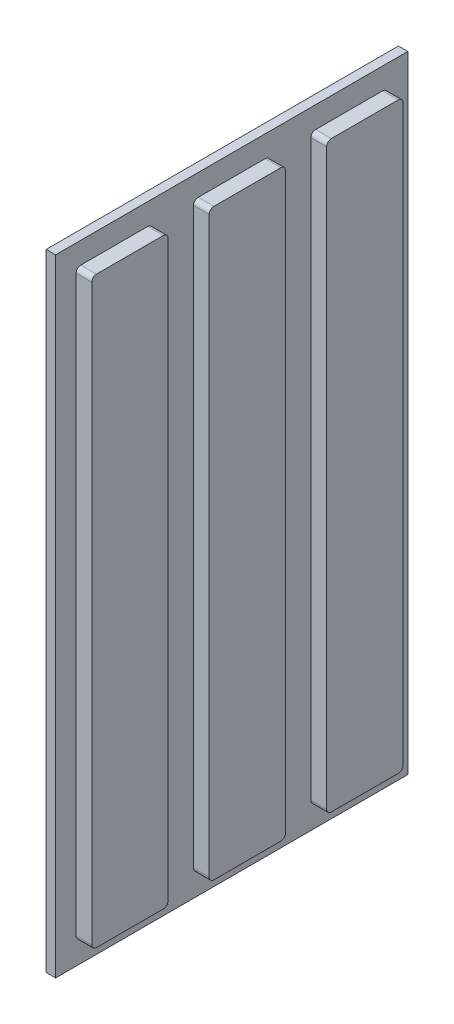
from build123d import *

# Parameters (mm, degrees)
SKETCH1_W           = 80
SKETCH1_H           = 45
BOSS_EXTRUDE1_DEPTH = 1.2
SKETCH2_W           = 74.5
SKETCH2_H           = 9.75
BOSS_EXTRUDE2_DEPTH = 2
LPATTERN1_COUNT     = 3
LPATTERN1_PITCH     = 15
SKETCH3_W           = 2.467948718
SKETCH3_H           = 0.224358974
CUT_EXTRUDE1_DEPTH  = 0.6
FILLET1_R           = 0.6


with BuildPart() as part:
    # Sketch1 → Boss-Extrude1 (new body)
    with BuildSketch(Plane.YZ):
        Rectangle(SKETCH1_W, SKETCH1_H)
    extrude(amount=-BOSS_EXTRUDE1_DEPTH)

    # Sketch2 → Boss-Extrude2 (add)
    with BuildSketch(Plane.YZ):
        with Locations((0, 15)):
            Rectangle(SKETCH2_W, SKETCH2_H)
    boss_extrude2 = extrude(amount=BOSS_EXTRUDE2_DEPTH)

    # LPattern1: Boss-Extrude2 ×3
    with Locations(*[(0, 0, -i * LPATTERN1_PITCH) for i in range(1, LPATTERN1_COUNT)]):
        add(boss_extrude2)

    # Sketch3 → Cut-Extrude1 (cut)
    # profile 1 of 10: a face of its own
    with BuildSketch(Plane(origin=(-1.2, 0, 0), x_dir=(0, -1, 0), z_dir=(-1, 0, 0))):
        with BuildLine():
            Line((-12.101362179, 4.78525641), (-12.658052885, 5.065705128))
            Line((-12.658052885, 5.065705128), (-12.048076923, 6.266025641))
            add(Edge.make_bspline(
                [(-12.048076923, 6.266025641), (-12.084115703, 6.266944222), (-12.154868548, 6.268747618), (-12.259046592, 6.283733822), (-12.358669547, 6.309316228), (-12.454911641, 6.343372857), (-12.546441874, 6.389029296), (-12.634370125, 6.44351786), (-12.717479169, 6.508985086), (-12.796158669, 6.582572956), (-12.867995567, 6.663911371), (-12.930348475, 6.75138946), (-12.984696207, 6.84278816), (-13.026959984, 6.940170863), (-13.060906465, 7.041722597), (-13.085709475, 7.147969005), (-13.099628269, 7.259376228), (-13.101573722, 7.335198766), (-13.102564103, 7.373798077)],
                knots=[0, 0, 0, 0, 1.014336294, 1.991387562, 2.955278539, 3.906441712, 4.859855302, 5.829322156, 6.813833455, 7.833278715, 8.858926674, 9.863225732, 10.85404919, 11.846815163, 12.845559416, 13.865450493, 14.913355531, 16, 16, 16, 16], degree=3))
            add(Edge.make_bspline(
                [(-13.102564103, 7.373798077), (-13.101645471, 7.411239029), (-13.099835326, 7.485015649), (-13.084801896, 7.593295719), (-13.060060763, 7.697260406), (-13.026116813, 7.796892046), (-12.980928779, 7.891518808), (-12.928037335, 7.982622327), (-12.863379945, 8.068317768), (-12.79033909, 8.148976108), (-12.71039975, 8.222764248), (-12.625590822, 8.287642055), (-12.536297917, 8.341873668), (-12.44366854, 8.387418218), (-12.346028345, 8.421446272), (-12.244788345, 8.447120187), (-12.139194366, 8.461937705), (-12.067519376, 8.463800811), (-12.03125, 8.46474359)],
                knots=[0, 0, 0, 0, 1.055538678, 2.079917126, 3.075849687, 4.065898488, 5.041806164, 6.028602842, 7.031727914, 8.062953097, 9.093756959, 10.095582084, 11.068815425, 12.035667573, 13.000833448, 13.979119574, 14.977382875, 16, 16, 16, 16], degree=3))
            add(Edge.make_bspline(
                [(-12.03125, 8.46474359), (-11.99332598, 8.463962965), (-11.918753525, 8.462427971), (-11.809589466, 8.445489925), (-11.705145713, 8.419503864), (-11.604997894, 8.384209492), (-11.510389302, 8.336307724), (-11.420528301, 8.278897121), (-11.335713797, 8.210707436), (-11.256856635, 8.133704107), (-11.185136929, 8.049948579), (-11.121566332, 7.962276747), (-11.068164333, 7.870860034), (-11.024424828, 7.776514303), (-10.990351975, 7.679091749), (-10.96693123, 7.578454183), (-10.951382453, 7.4747737), (-10.949613313, 7.40447067), (-10.948717949, 7.368890224)],
                knots=[0, 0, 0, 0, 1.062826075, 2.08990367, 3.089830715, 4.078784409, 5.060762809, 6.057138927, 7.064407536, 8.107320944, 9.143871033, 10.153461498, 11.140480137, 12.108246174, 13.065926856, 14.029354859, 15.002654194, 16, 16, 16, 16], degree=3))
            add(Edge.make_bspline(
                [(-10.948717949, 7.368890224), (-10.949206557, 7.341753863), (-10.950190725, 7.287095131), (-10.959867806, 7.205128437), (-10.974549888, 7.122934565), (-10.991591552, 7.053829904), (-11.009457366, 6.995578872), (-11.026842837, 6.946163674), (-11.049148909, 6.891303526), (-11.074055868, 6.830630714), (-11.102901057, 6.764411294), (-11.13628253, 6.692961821), (-11.1721828, 6.615222629), (-11.198644844, 6.562065628), (-11.212339744, 6.534555288)],
                knots=[0, 0, 0, 0, 1.105131805, 2.225983929, 3.357782449, 4.505488967, 5.122909461, 5.839607681, 6.638776516, 7.535249922, 8.51168636, 9.581005249, 10.748097757, 12, 12, 12, 12], degree=3))
            Line((-11.212339744, 6.534555288), (-12.101362179, 4.78525641))
        make_face()
        with BuildLine():
            add(Edge.make_bspline(
                [(-12.017227564, 6.849358974), (-11.987126592, 6.851131106), (-11.928316107, 6.854593449), (-11.843838757, 6.881365028), (-11.768235823, 6.927178471), (-11.701226199, 6.988042239), (-11.645851496, 7.06229882), (-11.605590464, 7.146833337), (-11.580790908, 7.239895173), (-11.578237119, 7.304697212), (-11.576923077, 7.338040865)],
                knots=[0, 0, 0, 0, 0.984774978, 1.924027336, 2.867853169, 3.859505234, 4.871392407, 5.881338128, 6.909850265, 8, 8, 8, 8], degree=3))
            add(Edge.make_bspline(
                [(-11.576923077, 7.338040865), (-11.578505698, 7.372078143), (-11.581584273, 7.438288776), (-11.606621399, 7.533584452), (-11.649404812, 7.619726092), (-11.707609198, 7.694606899), (-11.775562059, 7.757272569), (-11.851550511, 7.803048153), (-11.933729395, 7.831354307), (-11.990600058, 7.834798478), (-12.019330929, 7.836538462)],
                knots=[0, 0, 0, 0, 1.104110315, 2.147758178, 3.172670271, 4.206310416, 5.210906102, 6.157051016, 7.068948237, 8, 8, 8, 8], degree=3))
            add(Edge.make_bspline(
                [(-12.019330929, 7.836538462), (-12.049697848, 7.834842202), (-12.109323045, 7.83151161), (-12.194849639, 7.803273431), (-12.273691733, 7.758376891), (-12.342542742, 7.6954986), (-12.40213065, 7.621603948), (-12.443682926, 7.535171542), (-12.469970335, 7.440540876), (-12.472869791, 7.374211507), (-12.474358974, 7.340144231)],
                knots=[0, 0, 0, 0, 0.970967322, 1.90648639, 2.855811969, 3.858352357, 4.877096915, 5.878517833, 6.91039038, 8, 8, 8, 8], degree=3))
            add(Edge.make_bspline(
                [(-12.474358974, 7.340144231), (-12.472803431, 7.306562559), (-12.46977806, 7.241249713), (-12.444422381, 7.147660087), (-12.403120521, 7.062678206), (-12.346657932, 6.987836006), (-12.277109926, 6.926672356), (-12.19814352, 6.881346919), (-12.11005832, 6.854520858), (-12.048728169, 6.851110576), (-12.017227564, 6.849358974)],
                knots=[0, 0, 0, 0, 1.075706617, 2.092137047, 3.084482865, 4.090466434, 5.0784141, 6.035155512, 6.990809768, 8, 8, 8, 8], degree=3))
        make_face(mode=Mode.SUBTRACT)
    # profile 2 of 10: a face of its own
    with BuildSketch(Plane(origin=(-1.2, 0, 0), x_dir=(0, -1, 0), z_dir=(-1, 0, 0))):
        with BuildLine():
            Line((-9.871794872, 7.208333333), (-10.5, 7.208333333))
            add(Edge.make_bspline(
                [(-10.5, 7.208333333), (-10.497286878, 7.255853728), (-10.491985602, 7.348705726), (-10.470898463, 7.483576225), (-10.44264242, 7.611014017), (-10.404930981, 7.730573308), (-10.357544089, 7.842210656), (-10.301701133, 7.946306638), (-10.235975451, 8.042313186), (-10.161765902, 8.129767303), (-10.08033236, 8.208223199), (-9.993365465, 8.277787125), (-9.899534942, 8.335189525), (-9.80055515, 8.382426387), (-9.696442945, 8.420166444), (-9.586213261, 8.445398727), (-9.470820526, 8.462486275), (-9.391824855, 8.463981504), (-9.3515625, 8.46474359)],
                knots=[0, 0, 0, 0, 1.199038563, 2.342849363, 3.436047546, 4.486744587, 5.497670872, 6.488682221, 7.459191391, 8.424610317, 9.374430501, 10.305433194, 11.225809216, 12.140057399, 13.06607119, 14.010487599, 14.985989317, 16, 16, 16, 16], degree=3))
            add(Edge.make_bspline(
                [(-9.3515625, 8.46474359), (-9.30214103, 8.46320151), (-9.20565874, 8.460191008), (-9.065462319, 8.434510428), (-8.934534191, 8.391555691), (-8.812969528, 8.331536594), (-8.70180323, 8.255288623), (-8.601053733, 8.164375396), (-8.513767863, 8.056889507), (-8.4393922, 7.937303267), (-8.377594913, 7.81067827), (-8.334289949, 7.679742772), (-8.305826061, 7.54797127), (-8.302790212, 7.459243011), (-8.301282051, 7.415164263)],
                knots=[0, 0, 0, 0, 1.075374347, 2.099382735, 3.09057751, 4.06680945, 5.040638231, 6.016817125, 7.011024321, 8.044445721, 9.0776792, 10.070479129, 11.0414456, 12, 12, 12, 12], degree=3))
            add(Edge.make_bspline(
                [(-8.301282051, 7.415164263), (-8.301869249, 7.388502321), (-8.303051134, 7.334838418), (-8.311268935, 7.253631761), (-8.32359726, 7.170913287), (-8.342185369, 7.086753919), (-8.365366266, 7.001130065), (-8.393488044, 6.913785484), (-8.427203016, 6.825215386), (-8.465948547, 6.734422931), (-8.512172065, 6.641113351), (-8.565992925, 6.543887899), (-8.628839657, 6.442832821), (-8.699953151, 6.337377529), (-8.779678787, 6.22768834), (-8.868405761, 6.114095673), (-8.965112146, 5.996199265), (-9.033747387, 5.917392132), (-9.069010417, 5.876903045)],
                knots=[0, 0, 0, 0, 0.728284026, 1.46585585, 2.227944881, 3.01186502, 3.81876927, 4.650621989, 5.517437689, 6.406905708, 7.346299482, 8.360816762, 9.441613733, 10.596154504, 11.834900912, 13.145207542, 14.533280747, 16, 16, 16, 16], degree=3))
            Line((-9.069010417, 5.876903045), (-9.434294872, 5.458333333))
            Line((-9.434294872, 5.458333333), (-8.256410256, 5.458333333))
            Line((-8.256410256, 5.458333333), (-8.256410256, 4.875))
            Line((-8.256410256, 4.875), (-10.58974359, 4.875))
            Line((-10.58974359, 4.875), (-10.58974359, 5.193309295))
            Line((-10.58974359, 5.193309295), (-9.553485577, 6.296173878))
            add(Edge.make_bspline(
                [(-9.553485577, 6.296173878), (-9.523483245, 6.328344781), (-9.465377624, 6.390650278), (-9.382699314, 6.48215253), (-9.307882747, 6.568985982), (-9.242479305, 6.652075237), (-9.1830567, 6.728725216), (-9.132264581, 6.801246247), (-9.089638239, 6.868982712), (-9.0433613, 6.950661059), (-8.999413421, 7.048077022), (-8.959088581, 7.160304206), (-8.934507801, 7.267567547), (-8.931114876, 7.337462646), (-8.929487179, 7.37099359)],
                knots=[0, 0, 0, 0, 1.246127091, 2.413378631, 3.493388633, 4.492180848, 5.408488754, 6.240484944, 6.999099869, 7.674939598, 8.898438119, 10.020720584, 11.050475521, 12, 12, 12, 12], degree=3))
            add(Edge.make_bspline(
                [(-8.929487179, 7.37099359), (-8.930704169, 7.403432191), (-8.93306228, 7.466287182), (-8.958976013, 7.555698073), (-8.999122468, 7.636650506), (-9.055694492, 7.706725534), (-9.124220931, 7.764310831), (-9.203409669, 7.807141156), (-9.292615084, 7.831854058), (-9.355149779, 7.834947231), (-9.387319712, 7.836538462)],
                knots=[0, 0, 0, 0, 1.062038974, 2.057870785, 3.028805853, 4.01125022, 4.991535629, 5.949134679, 6.94496649, 8, 8, 8, 8], degree=3))
            add(Edge.make_bspline(
                [(-9.387319712, 7.836538462), (-9.403939109, 7.835950642), (-9.43665706, 7.834793424), (-9.484749892, 7.827090139), (-9.530513677, 7.813513903), (-9.574457791, 7.795323658), (-9.616113251, 7.771212358), (-9.655374989, 7.741491338), (-9.692656677, 7.706915879), (-9.727787326, 7.667594092), (-9.759760803, 7.623710967), (-9.788159528, 7.575667285), (-9.811640546, 7.52349287), (-9.832314087, 7.467876502), (-9.848258512, 7.408220817), (-9.859868031, 7.344882848), (-9.868693973, 7.277965636), (-9.870742435, 7.231966346), (-9.871794872, 7.208333333)],
                knots=[0, 0, 0, 0, 0.903469896, 1.778625579, 2.63899355, 3.493148037, 4.358286772, 5.247621495, 6.164656832, 7.118446693, 8.109501108, 9.111810964, 10.146451449, 11.215617525, 12.33435995, 13.498009769, 14.714554818, 16, 16, 16, 16], degree=3))
        make_face()
    # profile 3 of 10: a face of its own
    with BuildSketch(Plane(origin=(-1.2, 0, 0), x_dir=(0, -1, 0), z_dir=(-1, 0, 0))):
        with BuildLine():
            Line((-7.179487179, 7.208333333), (-7.807692308, 7.208333333))
            add(Edge.make_bspline(
                [(-7.807692308, 7.208333333), (-7.804979186, 7.255853728), (-7.799677909, 7.348705726), (-7.77859077, 7.483576225), (-7.750334728, 7.611014017), (-7.712623288, 7.730573308), (-7.665236397, 7.842210656), (-7.60939344, 7.946306638), (-7.543667758, 8.042313186), (-7.469458209, 8.129767303), (-7.388024667, 8.208223199), (-7.301057773, 8.277787125), (-7.207227249, 8.335189525), (-7.108247458, 8.382426387), (-7.004135253, 8.420166444), (-6.893905569, 8.445398727), (-6.778512834, 8.462486275), (-6.699517163, 8.463981504), (-6.659254808, 8.46474359)],
                knots=[0, 0, 0, 0, 1.199038563, 2.342849363, 3.436047546, 4.486744587, 5.497670872, 6.488682221, 7.459191391, 8.424610317, 9.374430501, 10.305433194, 11.225809216, 12.140057399, 13.06607119, 14.010487599, 14.985989317, 16, 16, 16, 16], degree=3))
            add(Edge.make_bspline(
                [(-6.659254808, 8.46474359), (-6.609833338, 8.46320151), (-6.513351048, 8.460191008), (-6.373154627, 8.434510428), (-6.242226499, 8.391555691), (-6.120661835, 8.331536594), (-6.009495538, 8.255288623), (-5.908746041, 8.164375396), (-5.82146017, 8.056889507), (-5.747084507, 7.937303267), (-5.685287221, 7.81067827), (-5.641982256, 7.679742772), (-5.613518369, 7.54797127), (-5.610482519, 7.459243011), (-5.608974359, 7.415164263)],
                knots=[0, 0, 0, 0, 1.075374347, 2.099382735, 3.09057751, 4.06680945, 5.040638231, 6.016817125, 7.011024321, 8.044445721, 9.0776792, 10.070479129, 11.0414456, 12, 12, 12, 12], degree=3))
            add(Edge.make_bspline(
                [(-5.608974359, 7.415164263), (-5.609561557, 7.388502321), (-5.610743442, 7.334838418), (-5.618961242, 7.253631761), (-5.631289567, 7.170913287), (-5.649877677, 7.086753919), (-5.673058574, 7.001130065), (-5.701180352, 6.913785484), (-5.734895324, 6.825215386), (-5.773640855, 6.734422931), (-5.819864372, 6.641113351), (-5.873685233, 6.543887899), (-5.936531965, 6.442832821), (-6.007645458, 6.337377529), (-6.087371095, 6.22768834), (-6.176098069, 6.114095673), (-6.272804453, 5.996199265), (-6.341439695, 5.917392132), (-6.376702724, 5.876903045)],
                knots=[0, 0, 0, 0, 0.728284026, 1.46585585, 2.227944881, 3.01186502, 3.81876927, 4.650621989, 5.517437689, 6.406905708, 7.346299482, 8.360816762, 9.441613733, 10.596154504, 11.834900912, 13.145207542, 14.533280747, 16, 16, 16, 16], degree=3))
            Line((-6.376702724, 5.876903045), (-6.741987179, 5.458333333))
            Line((-6.741987179, 5.458333333), (-5.564102564, 5.458333333))
            Line((-5.564102564, 5.458333333), (-5.564102564, 4.875))
            Line((-5.564102564, 4.875), (-7.897435897, 4.875))
            Line((-7.897435897, 4.875), (-7.897435897, 5.193309295))
            Line((-7.897435897, 5.193309295), (-6.861177885, 6.296173878))
            add(Edge.make_bspline(
                [(-6.861177885, 6.296173878), (-6.831175552, 6.328344781), (-6.773069932, 6.390650278), (-6.690391622, 6.48215253), (-6.615575054, 6.568985982), (-6.550171613, 6.652075237), (-6.490749007, 6.728725216), (-6.439956888, 6.801246247), (-6.397330547, 6.868982712), (-6.351053608, 6.950661059), (-6.307105728, 7.048077022), (-6.266780889, 7.160304206), (-6.242200108, 7.267567547), (-6.238807183, 7.337462646), (-6.237179487, 7.37099359)],
                knots=[0, 0, 0, 0, 1.246127091, 2.413378631, 3.493388633, 4.492180848, 5.408488754, 6.240484944, 6.999099869, 7.674939598, 8.898438119, 10.020720584, 11.050475521, 12, 12, 12, 12], degree=3))
            add(Edge.make_bspline(
                [(-6.237179487, 7.37099359), (-6.238396476, 7.403432191), (-6.240754588, 7.466287182), (-6.266668321, 7.555698073), (-6.306814775, 7.636650506), (-6.363386799, 7.706725534), (-6.431913239, 7.764310831), (-6.511101976, 7.807141156), (-6.600307391, 7.831854058), (-6.662842087, 7.834947231), (-6.695012019, 7.836538462)],
                knots=[0, 0, 0, 0, 1.062038974, 2.057870785, 3.028805853, 4.01125022, 4.991535629, 5.949134679, 6.94496649, 8, 8, 8, 8], degree=3))
            add(Edge.make_bspline(
                [(-6.695012019, 7.836538462), (-6.711631416, 7.835950642), (-6.744349368, 7.834793424), (-6.7924422, 7.827090139), (-6.838205985, 7.813513903), (-6.882150099, 7.795323658), (-6.923805559, 7.771212358), (-6.963067297, 7.741491338), (-7.000348985, 7.706915879), (-7.035479634, 7.667594092), (-7.06745311, 7.623710967), (-7.095851835, 7.575667285), (-7.119332853, 7.52349287), (-7.140006395, 7.467876502), (-7.15595082, 7.408220817), (-7.167560339, 7.344882848), (-7.176386281, 7.277965636), (-7.178434743, 7.231966346), (-7.179487179, 7.208333333)],
                knots=[0, 0, 0, 0, 0.903469896, 1.778625579, 2.63899355, 3.493148037, 4.358286772, 5.247621495, 6.164656832, 7.118446693, 8.109501108, 9.111810964, 10.146451449, 11.215617525, 12.33435995, 13.498009769, 14.714554818, 16, 16, 16, 16], degree=3))
        make_face()
    # profile 4 of 10: a face of its own
    with BuildSketch(Plane(origin=(-1.2, 0, 0), x_dir=(0, -1, 0), z_dir=(-1, 0, 0))):
        with BuildLine():
            Line((-4.487179487, 7.208333333), (-5.115384615, 7.208333333))
            add(Edge.make_bspline(
                [(-5.115384615, 7.208333333), (-5.112671494, 7.255853728), (-5.107370217, 7.348705726), (-5.086283078, 7.483576225), (-5.058027036, 7.611014017), (-5.020315596, 7.730573308), (-4.972928705, 7.842210656), (-4.917085748, 7.946306638), (-4.851360066, 8.042313186), (-4.777150517, 8.129767303), (-4.695716975, 8.208223199), (-4.60875008, 8.277787125), (-4.514919557, 8.335189525), (-4.415939766, 8.382426387), (-4.31182756, 8.420166444), (-4.201597876, 8.445398727), (-4.086205141, 8.462486275), (-4.00720947, 8.463981504), (-3.966947115, 8.46474359)],
                knots=[0, 0, 0, 0, 1.199038563, 2.342849363, 3.436047546, 4.486744587, 5.497670872, 6.488682221, 7.459191391, 8.424610317, 9.374430501, 10.305433194, 11.225809216, 12.140057399, 13.06607119, 14.010487599, 14.985989317, 16, 16, 16, 16], degree=3))
            add(Edge.make_bspline(
                [(-3.966947115, 8.46474359), (-3.917525646, 8.46320151), (-3.821043356, 8.460191008), (-3.680846935, 8.434510428), (-3.549918806, 8.391555691), (-3.428354143, 8.331536594), (-3.317187846, 8.255288623), (-3.216438349, 8.164375396), (-3.129152478, 8.056889507), (-3.054776815, 7.937303267), (-2.992979528, 7.81067827), (-2.949674564, 7.679742772), (-2.921210677, 7.54797127), (-2.918174827, 7.459243011), (-2.916666667, 7.415164263)],
                knots=[0, 0, 0, 0, 1.075374347, 2.099382735, 3.09057751, 4.06680945, 5.040638231, 6.016817125, 7.011024321, 8.044445721, 9.0776792, 10.070479129, 11.0414456, 12, 12, 12, 12], degree=3))
            add(Edge.make_bspline(
                [(-2.916666667, 7.415164263), (-2.917253865, 7.388502321), (-2.918435749, 7.334838418), (-2.92665355, 7.253631761), (-2.938981875, 7.170913287), (-2.957569985, 7.086753919), (-2.980750881, 7.001130065), (-3.008872659, 6.913785484), (-3.042587631, 6.825215386), (-3.081333163, 6.734422931), (-3.12755668, 6.641113351), (-3.181377541, 6.543887899), (-3.244224272, 6.442832821), (-3.315337766, 6.337377529), (-3.395063402, 6.22768834), (-3.483790376, 6.114095673), (-3.580496761, 5.996199265), (-3.649132003, 5.917392132), (-3.684395032, 5.876903045)],
                knots=[0, 0, 0, 0, 0.728284026, 1.46585585, 2.227944881, 3.01186502, 3.81876927, 4.650621989, 5.517437689, 6.406905708, 7.346299482, 8.360816762, 9.441613733, 10.596154504, 11.834900912, 13.145207542, 14.533280747, 16, 16, 16, 16], degree=3))
            Line((-3.684395032, 5.876903045), (-4.049679487, 5.458333333))
            Line((-4.049679487, 5.458333333), (-2.871794872, 5.458333333))
            Line((-2.871794872, 5.458333333), (-2.871794872, 4.875))
            Line((-2.871794872, 4.875), (-5.205128205, 4.875))
            Line((-5.205128205, 4.875), (-5.205128205, 5.193309295))
            Line((-5.205128205, 5.193309295), (-4.168870192, 6.296173878))
            add(Edge.make_bspline(
                [(-4.168870192, 6.296173878), (-4.13886786, 6.328344781), (-4.080762239, 6.390650278), (-3.998083929, 6.48215253), (-3.923267362, 6.568985982), (-3.85786392, 6.652075237), (-3.798441315, 6.728725216), (-3.747649196, 6.801246247), (-3.705022855, 6.868982712), (-3.658745916, 6.950661059), (-3.614798036, 7.048077022), (-3.574473196, 7.160304206), (-3.549892416, 7.267567547), (-3.546499491, 7.337462646), (-3.544871795, 7.37099359)],
                knots=[0, 0, 0, 0, 1.246127091, 2.413378631, 3.493388633, 4.492180848, 5.408488754, 6.240484944, 6.999099869, 7.674939598, 8.898438119, 10.020720584, 11.050475521, 12, 12, 12, 12], degree=3))
            add(Edge.make_bspline(
                [(-3.544871795, 7.37099359), (-3.546088784, 7.403432191), (-3.548446895, 7.466287182), (-3.574360629, 7.555698073), (-3.614507083, 7.636650506), (-3.671079107, 7.706725534), (-3.739605546, 7.764310831), (-3.818794284, 7.807141156), (-3.907999699, 7.831854058), (-3.970534394, 7.834947231), (-4.002704327, 7.836538462)],
                knots=[0, 0, 0, 0, 1.062038974, 2.057870785, 3.028805853, 4.01125022, 4.991535629, 5.949134679, 6.94496649, 8, 8, 8, 8], degree=3))
            add(Edge.make_bspline(
                [(-4.002704327, 7.836538462), (-4.019323724, 7.835950642), (-4.052041676, 7.834793424), (-4.100134508, 7.827090139), (-4.145898293, 7.813513903), (-4.189842407, 7.795323658), (-4.231497867, 7.771212358), (-4.270759605, 7.741491338), (-4.308041293, 7.706915879), (-4.343171941, 7.667594092), (-4.375145418, 7.623710967), (-4.403544143, 7.575667285), (-4.427025161, 7.52349287), (-4.447698703, 7.467876502), (-4.463643127, 7.408220817), (-4.475252646, 7.344882848), (-4.484078588, 7.277965636), (-4.486127051, 7.231966346), (-4.487179487, 7.208333333)],
                knots=[0, 0, 0, 0, 0.903469896, 1.778625579, 2.63899355, 3.493148037, 4.358286772, 5.247621495, 6.164656832, 7.118446693, 8.109501108, 9.111810964, 10.146451449, 11.215617525, 12.33435995, 13.498009769, 14.714554818, 16, 16, 16, 16], degree=3))
        make_face()
    # profile 5 of 10: a face of its own
    with BuildSketch(Plane(origin=(-1.2, 0, 0), x_dir=(0, -1, 0), z_dir=(-1, 0, 0))):
        with BuildLine():
            Line((-1.66025641, 7.522435897), (-2.288461538, 7.522435897))
            add(Edge.make_bspline(
                [(-2.288461538, 7.522435897), (-2.284026171, 7.553837631), (-2.275330928, 7.615398649), (-2.254524373, 7.704523667), (-2.229637489, 7.789064846), (-2.198567485, 7.868754462), (-2.162127425, 7.943734468), (-2.120687864, 8.014262159), (-2.073800824, 8.080034816), (-2.037861411, 8.119656526), (-2.019931891, 8.139423077)],
                knots=[0, 0, 0, 0, 1.111473889, 2.178970933, 3.205615836, 4.199322666, 5.174200091, 6.12565194, 7.064921805, 8, 8, 8, 8], degree=3))
            add(Edge.make_bspline(
                [(-2.019931891, 8.139423077), (-1.994070934, 8.165503609), (-1.943101706, 8.216905597), (-1.857926148, 8.282745865), (-1.768646433, 8.33972614), (-1.673472018, 8.384900514), (-1.573883887, 8.421463936), (-1.469090083, 8.446023669), (-1.359518829, 8.462319269), (-1.284750233, 8.463924443), (-1.246594551, 8.46474359)],
                knots=[0, 0, 0, 0, 1.01925491, 2.00884431, 2.983262333, 3.955970413, 4.92937149, 5.924503185, 6.940838805, 8, 8, 8, 8], degree=3))
            add(Edge.make_bspline(
                [(-1.246594551, 8.46474359), (-1.212672187, 8.463942749), (-1.145987655, 8.462368458), (-1.047978171, 8.449730903), (-0.95453433, 8.427566039), (-0.864668404, 8.398585976), (-0.779702027, 8.359153758), (-0.697759909, 8.313381345), (-0.621131516, 8.257239579), (-0.549637552, 8.193805033), (-0.48395671, 8.125194362), (-0.427076813, 8.051855197), (-0.378176146, 7.975746596), (-0.337888463, 7.896236241), (-0.30691271, 7.81318959), (-0.285414619, 7.727086394), (-0.271343596, 7.638116644), (-0.269941755, 7.577645104), (-0.269230769, 7.54697516)],
                knots=[0, 0, 0, 0, 1.091422571, 2.145516843, 3.172569842, 4.178562979, 5.178154469, 6.181868002, 7.194278174, 8.227918432, 9.254613415, 10.245994977, 11.209837596, 12.161663635, 13.10878368, 14.055455738, 15.013766427, 16, 16, 16, 16], degree=3))
            add(Edge.make_bspline(
                [(-0.269230769, 7.54697516), (-0.270689754, 7.508992989), (-0.273562048, 7.434217771), (-0.297131293, 7.324778683), (-0.334023571, 7.220135386), (-0.387318055, 7.121751995), (-0.453949734, 7.029896255), (-0.535704573, 6.947639179), (-0.630253981, 6.873691089), (-0.701233481, 6.833951376), (-0.737580128, 6.813601763)],
                knots=[0, 0, 0, 0, 0.992805628, 1.954529043, 2.915727527, 3.886831945, 4.871318353, 5.87440735, 6.911542536, 8, 8, 8, 8], degree=3))
            add(Edge.make_bspline(
                [(-0.737580128, 6.813601763), (-0.712632347, 6.805410881), (-0.663611076, 6.789316166), (-0.593933233, 6.757617805), (-0.527677567, 6.722976752), (-0.465984975, 6.68273298), (-0.408241851, 6.638513768), (-0.354800204, 6.589941116), (-0.305340732, 6.537120934), (-0.26067084, 6.47976273), (-0.221024566, 6.418783839), (-0.185452075, 6.355592836), (-0.156173933, 6.289231418), (-0.131371701, 6.220457477), (-0.112488694, 6.14865291), (-0.099193369, 6.074095953), (-0.091508345, 5.996956675), (-0.090336248, 5.944694861), (-0.08974359, 5.918269231)],
                knots=[0, 0, 0, 0, 1.059543567, 2.081955587, 3.086750234, 4.076226789, 5.052108497, 6.020845489, 6.989030705, 7.970690546, 8.952259656, 9.923888338, 10.895517021, 11.877585046, 12.873342345, 13.889638361, 14.932918083, 16, 16, 16, 16], degree=3))
            add(Edge.make_bspline(
                [(-0.08974359, 5.918269231), (-0.090944988, 5.879434283), (-0.093313901, 5.802859676), (-0.108374341, 5.690073116), (-0.136414166, 5.582541152), (-0.173302109, 5.479026466), (-0.222506622, 5.380865394), (-0.280412061, 5.285805276), (-0.351589481, 5.197142768), (-0.430690961, 5.112533864), (-0.518537766, 5.035611238), (-0.613777994, 4.968922782), (-0.714317394, 4.911692221), (-0.82079205, 4.865230822), (-0.933164971, 4.82945023), (-1.051185687, 4.803586369), (-1.175350089, 4.787762431), (-1.260102007, 4.786103592), (-1.303385417, 4.78525641)],
                knots=[0, 0, 0, 0, 1.005138573, 1.981928558, 2.936866704, 3.876260664, 4.820238198, 5.773547, 6.751179199, 7.756627054, 8.768222608, 9.766606018, 10.760583154, 11.757261445, 12.767156078, 13.807575856, 14.880313354, 16, 16, 16, 16], degree=3))
            add(Edge.make_bspline(
                [(-1.303385417, 4.78525641), (-1.344330824, 4.78614962), (-1.424394149, 4.787896173), (-1.541503519, 4.803013474), (-1.65280489, 4.827398908), (-1.758582305, 4.861772198), (-1.858426519, 4.906348482), (-1.95324296, 4.959428835), (-2.041139584, 5.024074806), (-2.123095735, 5.097368157), (-2.197293378, 5.179599134), (-2.263608597, 5.268862899), (-2.32057913, 5.365498884), (-2.368438615, 5.469094222), (-2.406812899, 5.579830648), (-2.437082421, 5.697482976), (-2.458226178, 5.82228106), (-2.464665553, 5.908144797), (-2.467948718, 5.951923077)],
                knots=[0, 0, 0, 0, 1.066544725, 2.085487077, 3.070979577, 4.031932826, 4.977951092, 5.916076795, 6.857635327, 7.814973522, 8.776389752, 9.738577119, 10.707772778, 11.69409279, 12.707140348, 13.757286496, 14.856535458, 16, 16, 16, 16], degree=3))
            Line((-2.467948718, 5.951923077), (-1.83974359, 5.951923077))
            add(Edge.make_bspline(
                [(-1.83974359, 5.951923077), (-1.835762719, 5.929910783), (-1.82800893, 5.887036069), (-1.81288564, 5.824963013), (-1.793177884, 5.767665749), (-1.770390813, 5.71463502), (-1.745777347, 5.665174551), (-1.716038394, 5.621111038), (-1.683353068, 5.581247979), (-1.636187904, 5.533858334), (-1.568762054, 5.485167452), (-1.477714819, 5.442852759), (-1.376433392, 5.418051151), (-1.305627573, 5.41502543), (-1.269030449, 5.413461538)],
                knots=[0, 0, 0, 0, 0.928156231, 1.807827665, 2.648129825, 3.438902246, 4.202261636, 4.936546065, 5.639352463, 6.338805438, 7.70633318, 9.064371875, 10.482673459, 12, 12, 12, 12], degree=3))
            add(Edge.make_bspline(
                [(-1.269030449, 5.413461538), (-1.249610721, 5.413794555), (-1.211571819, 5.414446859), (-1.155698335, 5.421676775), (-1.102470976, 5.433584452), (-1.0517906, 5.449766545), (-1.003334575, 5.47005181), (-0.958028702, 5.496208445), (-0.914949532, 5.526619267), (-0.874565376, 5.560809104), (-0.837249584, 5.598063787), (-0.806200651, 5.63931702), (-0.777824173, 5.681237678), (-0.756836725, 5.726568358), (-0.738447199, 5.772869785), (-0.72719187, 5.821822556), (-0.718693288, 5.872399774), (-0.718199384, 5.907012602), (-0.717948718, 5.924579327)],
                knots=[0, 0, 0, 0, 1.110435564, 2.175094844, 3.216326037, 4.226890168, 5.215276772, 6.21526065, 7.213097102, 8.228249917, 9.239874822, 10.221364777, 11.178138315, 12.128914389, 13.072518965, 14.022636769, 14.996447288, 16, 16, 16, 16], degree=3))
            add(Edge.make_bspline(
                [(-0.717948718, 5.924579327), (-0.71861419, 5.943791534), (-0.719938992, 5.982038636), (-0.730762763, 6.03785224), (-0.747855786, 6.091540428), (-0.771600083, 6.142865444), (-0.803307945, 6.191638115), (-0.840722869, 6.238836968), (-0.886792531, 6.282005386), (-0.93733712, 6.324676059), (-0.995948987, 6.361872017), (-1.059773652, 6.396198421), (-1.130488526, 6.423511641), (-1.206367395, 6.447907405), (-1.28884558, 6.465725692), (-1.377410921, 6.478663506), (-1.47192055, 6.488293703), (-1.537067265, 6.489675313), (-1.570512821, 6.490384615)],
                knots=[0, 0, 0, 0, 0.809814727, 1.612155564, 2.388397, 3.182215007, 3.988903953, 4.837162975, 5.715530372, 6.646997145, 7.623086902, 8.637258368, 9.698941581, 10.815059213, 11.996518529, 13.252603015, 14.589518788, 16, 16, 16, 16], degree=3))
            Line((-1.570512821, 6.490384615), (-1.570512821, 7.073717949))
            add(Edge.make_bspline(
                [(-1.570512821, 7.073717949), (-1.528871115, 7.07726429), (-1.45096773, 7.083898791), (-1.342833655, 7.099413803), (-1.251798703, 7.120152172), (-1.175674848, 7.145171891), (-1.112466476, 7.177303729), (-1.057247991, 7.212775858), (-1.00969122, 7.253971553), (-0.969499369, 7.299662363), (-0.937347138, 7.348730008), (-0.914591663, 7.400411832), (-0.899565135, 7.453108735), (-0.898141373, 7.489151828), (-0.897435897, 7.507011218)],
                knots=[0, 0, 0, 0, 1.70044513, 3.18119609, 4.440695891, 5.496282586, 6.431922213, 7.318171381, 8.16090191, 8.983045123, 9.787564368, 10.536848927, 11.275007137, 12, 12, 12, 12], degree=3))
            add(Edge.make_bspline(
                [(-0.897435897, 7.507011218), (-0.898653045, 7.52979786), (-0.901028659, 7.574272562), (-0.919478966, 7.637925229), (-0.951506609, 7.694666306), (-0.994450054, 7.744376394), (-1.046778135, 7.785897985), (-1.10811582, 7.816041952), (-1.177132076, 7.833752878), (-1.225688731, 7.835588905), (-1.250801282, 7.836538462)],
                knots=[0, 0, 0, 0, 1.009664648, 1.970651636, 2.907870547, 3.878035693, 4.867062054, 5.849714035, 6.887914197, 8, 8, 8, 8], degree=3))
            add(Edge.make_bspline(
                [(-1.250801282, 7.836538462), (-1.273562986, 7.835418084), (-1.318729179, 7.833194913), (-1.384775672, 7.816601749), (-1.447497835, 7.788669222), (-1.505596871, 7.750151914), (-1.558234107, 7.70389426), (-1.601434091, 7.64911167), (-1.63736579, 7.589086265), (-1.652596291, 7.544739782), (-1.66025641, 7.522435897)],
                knots=[0, 0, 0, 0, 0.98818071, 1.960853194, 2.938124878, 3.957524365, 4.978590984, 5.968022688, 6.978025184, 8, 8, 8, 8], degree=3))
        make_face()
    # profile 6 of 10: a face of its own
    with BuildSketch(Plane(origin=(-1.2, 0, 0), x_dir=(0, -1, 0), z_dir=(-1, 0, 0))):
        with BuildLine():
            add(Edge.make_bspline(
                [(1.402944712, 8.46474359), (1.433352447, 8.464292178), (1.49314218, 8.463404583), (1.581201201, 8.453791201), (1.666026385, 8.439268063), (1.747949579, 8.419013349), (1.826381092, 8.392206957), (1.901891763, 8.360120165), (1.973582798, 8.321069956), (2.042368485, 8.276960738), (2.10822233, 8.227022851), (2.169561581, 8.17009108), (2.227506422, 8.10747543), (2.280802562, 8.038229263), (2.330630259, 7.962982447), (2.376825789, 7.88172305), (2.419035513, 7.794053361), (2.457732501, 7.699815174), (2.49233547, 7.597595899), (2.521481507, 7.486223037), (2.546479112, 7.365671153), (2.567578854, 7.235640176), (2.583526848, 7.095957264), (2.594276118, 6.946715214), (2.601652775, 6.788201744), (2.602254807, 6.679462806), (2.602564103, 6.623597756)],
                knots=[0, 0, 0, 0, 0.879237366, 1.728815576, 2.559023295, 3.367336655, 4.166867292, 4.954216142, 5.737608147, 6.525189134, 7.316157332, 8.124696809, 8.942788509, 9.781158001, 10.649253743, 11.551476218, 12.482711956, 13.461909668, 14.496590415, 15.601789533, 16.789733467, 18.056700938, 19.410929216, 20.8549011, 22.384193279, 24, 24, 24, 24], degree=3))
            add(Edge.make_bspline(
                [(2.602564103, 6.623597756), (2.602229837, 6.567033772), (2.601580366, 6.457130965), (2.594582768, 6.29716765), (2.582532573, 6.146842014), (2.567001413, 6.006169608), (2.545727971, 5.875224719), (2.520813814, 5.753668289), (2.491207715, 5.641544378), (2.455464936, 5.539105625), (2.417002181, 5.444701935), (2.374676996, 5.357203181), (2.329227101, 5.276372369), (2.281694981, 5.200990055), (2.22947475, 5.133278471), (2.175108113, 5.070935071), (2.116227851, 5.016334593), (2.055313049, 4.966663175), (1.990132153, 4.923737102), (1.921357355, 4.886194666), (1.847762521, 4.855743291), (1.770689159, 4.829258312), (1.688823538, 4.810244955), (1.603466492, 4.79515848), (1.513654356, 4.786820769), (1.452506637, 4.785786421), (1.421173878, 4.78525641)],
                knots=[0, 0, 0, 0, 1.643780988, 3.193836972, 4.651895693, 6.025988579, 7.305620092, 8.505800249, 9.631074763, 10.672816429, 11.65661981, 12.592235626, 13.49536222, 14.350718032, 15.179365177, 15.97804903, 16.751647189, 17.51006938, 18.259804725, 19.016521909, 19.783502495, 20.571750527, 21.382245291, 22.22305063, 23.089471752, 24, 24, 24, 24], degree=3))
            add(Edge.make_bspline(
                [(1.421173878, 4.78525641), (1.389841965, 4.785796645), (1.328463209, 4.786854957), (1.238408212, 4.795096486), (1.152598816, 4.81030607), (1.070085507, 4.829404282), (0.991442563, 4.85568469), (0.916292895, 4.887047148), (0.845214338, 4.924355338), (0.778010087, 4.967381425), (0.714909597, 5.016720504), (0.654932285, 5.071844838), (0.598210826, 5.132614701), (0.545608094, 5.199710765), (0.496262607, 5.272237439), (0.450688961, 5.351022941), (0.408914546, 5.435952561), (0.369632649, 5.527144684), (0.335501653, 5.62656257), (0.305126651, 5.735094009), (0.280244248, 5.8536437), (0.260232155, 5.982173557), (0.244254512, 6.120411285), (0.232368981, 6.268423606), (0.225332515, 6.426279462), (0.224689854, 6.534781655), (0.224358974, 6.590645032)],
                knots=[0, 0, 0, 0, 0.917216111, 1.796812873, 2.643793957, 3.46689424, 4.273913431, 5.068098542, 5.848489301, 6.620921603, 7.401012384, 8.190319798, 9.003608147, 9.831726257, 10.68377682, 11.569763213, 12.493818149, 13.453288342, 14.474581811, 15.568529029, 16.750744269, 18.018426408, 19.375425659, 20.823733699, 22.36466933, 24, 24, 24, 24], degree=3))
            add(Edge.make_bspline(
                [(0.224358974, 6.590645032), (0.224958332, 6.668262797), (0.226114801, 6.818027275), (0.240770421, 7.034393402), (0.262281155, 7.234386406), (0.293875327, 7.417671749), (0.332941084, 7.584928265), (0.38296682, 7.735054156), (0.439917481, 7.870126752), (0.488446761, 7.950144571), (0.51181891, 7.988681891)],
                knots=[0, 0, 0, 0, 1.288568992, 2.486310467, 3.599230591, 4.627010532, 5.572937695, 6.447898582, 7.252493626, 8, 8, 8, 8], degree=3))
            add(Edge.make_bspline(
                [(0.51181891, 7.988681891), (0.538994932, 8.026540942), (0.59212941, 8.100562848), (0.68503653, 8.197739774), (0.784853134, 8.280850239), (0.893629398, 8.34801338), (1.00964498, 8.400978238), (1.133895934, 8.438386721), (1.26592342, 8.460182647), (1.356588898, 8.463200572), (1.402944712, 8.46474359)],
                knots=[0, 0, 0, 0, 1.058512271, 2.069600068, 3.047294572, 4.004278952, 4.967380941, 5.939006123, 6.946246673, 8, 8, 8, 8], degree=3))
        make_face()
        with BuildLine():
            add(Edge.make_bspline(
                [(1.418369391, 7.836538462), (1.390880546, 7.835235545), (1.336987818, 7.832681137), (1.258786901, 7.810997815), (1.185048319, 7.777506756), (1.128957349, 7.737205503), (1.086973816, 7.698571918), (1.057639621, 7.663609781), (1.029351413, 7.624594555), (1.004365843, 7.579765685), (0.980772942, 7.530733924), (0.957715567, 7.477276698), (0.938814575, 7.418080981), (0.92024485, 7.354154885), (0.903976039, 7.283731022), (0.890346341, 7.206233756), (0.878169405, 7.121159114), (0.869675846, 7.028451372), (0.861757301, 6.928207526), (0.856080913, 6.820204271), (0.853707757, 6.704470744), (0.852953403, 6.624766781), (0.852564103, 6.583633814)],
                knots=[0, 0, 0, 0, 1.076674018, 2.110852608, 3.161083442, 4.239746716, 4.804137807, 5.395870207, 6.026861976, 6.692161227, 7.405688833, 8.16177676, 8.973626916, 9.841385931, 10.773283133, 11.807421078, 12.927755683, 14.143907515, 15.458935494, 16.872852025, 18.386167141, 20, 20, 20, 20], degree=3))
            add(Edge.make_bspline(
                [(0.852564103, 6.583633814), (0.853204844, 6.530344067), (0.854433514, 6.428157026), (0.860868714, 6.281208503), (0.873767536, 6.147473515), (0.889811067, 6.026045689), (0.912344862, 5.917712518), (0.938271451, 5.82144907), (0.970288483, 5.73848247), (1.007290333, 5.667612834), (1.048271549, 5.607324181), (1.092758462, 5.556078555), (1.139236451, 5.511702261), (1.189156247, 5.475655944), (1.242398754, 5.448031708), (1.298519497, 5.428161936), (1.35755414, 5.415998822), (1.397980454, 5.414312189), (1.418369391, 5.413461538)],
                knots=[0, 0, 0, 0, 1.771748488, 3.397459088, 4.888034009, 6.237357457, 7.467047327, 8.564189669, 9.548206622, 10.417051504, 11.216568818, 11.965764335, 12.669334354, 13.348544111, 14.005342236, 14.656555988, 15.322436492, 16, 16, 16, 16], degree=3))
            add(Edge.make_bspline(
                [(1.418369391, 5.413461538), (1.438058644, 5.414043617), (1.476607754, 5.415183253), (1.53282099, 5.426881469), (1.58598022, 5.445900227), (1.63592494, 5.472803595), (1.682833795, 5.507015344), (1.726477524, 5.548685815), (1.766526974, 5.598230366), (1.789859966, 5.634999749), (1.801883013, 5.653946314)],
                knots=[0, 0, 0, 0, 0.992283464, 1.942767638, 2.88273346, 3.832339453, 4.79467288, 5.803907806, 6.868395428, 8, 8, 8, 8], degree=3))
            add(Edge.make_bspline(
                [(1.801883013, 5.653946314), (1.816038126, 5.679836189), (1.84572025, 5.734125158), (1.880068456, 5.825735767), (1.908980861, 5.929057394), (1.933865345, 6.044411585), (1.950884814, 6.17225331), (1.96554196, 6.311771915), (1.972611466, 6.463669958), (1.973761359, 6.56890547), (1.974358974, 6.623597756)],
                knots=[0, 0, 0, 0, 0.710965849, 1.490837728, 2.352621235, 3.297892224, 4.334225155, 5.461620853, 6.680770821, 8, 8, 8, 8], degree=3))
            add(Edge.make_bspline(
                [(1.974358974, 6.623597756), (1.974128129, 6.678764798), (1.97368379, 6.784951935), (1.965531463, 6.937396063), (1.954178725, 7.076628473), (1.937572946, 7.202338316), (1.916206594, 7.314830761), (1.889872484, 7.414098454), (1.858826527, 7.500337033), (1.822009722, 7.573460505), (1.781232823, 7.635605426), (1.737946901, 7.688920947), (1.691968923, 7.734440394), (1.643375781, 7.772335064), (1.59104277, 7.801289435), (1.535969517, 7.821733616), (1.478043119, 7.834101659), (1.438529115, 7.835715231), (1.418369391, 7.836538462)],
                knots=[0, 0, 0, 0, 1.793836731, 3.452829483, 4.963243077, 6.335886805, 7.574563692, 8.684454726, 9.672768357, 10.54971625, 11.340229787, 12.085688095, 12.778991901, 13.440269426, 14.083255152, 14.715733572, 15.344777694, 16, 16, 16, 16], degree=3))
        make_face(mode=Mode.SUBTRACT)
    # profile 7 of 10: a face of its own
    with BuildSketch(Plane(origin=(-1.2, 0, 0), x_dir=(0, -1, 0), z_dir=(-1, 0, 0))):
        with BuildLine():
            Line((4.159054487, 8.46474359), (4.715745192, 8.182191506))
            Line((4.715745192, 8.182191506), (4.105769231, 6.983974359))
            add(Edge.make_bspline(
                [(4.105769231, 6.983974359), (4.141807957, 6.98305571), (4.212560696, 6.981252179), (4.316739507, 6.966266952), (4.416359621, 6.940680927), (4.51261218, 6.906637625), (4.604103145, 6.860931185), (4.692304181, 6.806557567), (4.774933979, 6.740244048), (4.853887031, 6.666771943), (4.925678644, 6.585375478), (4.98804235, 6.497912372), (5.042391219, 6.406510636), (5.084639842, 6.309125384), (5.118718989, 6.20737089), (5.143308593, 6.100840396), (5.15733765, 5.989225415), (5.159271789, 5.913400302), (5.16025641, 5.874799679)],
                knots=[0, 0, 0, 0, 1.013672955, 1.990085268, 2.953345895, 3.903887042, 4.856677135, 5.825509993, 6.813434118, 7.832212698, 8.85718992, 9.860832204, 10.8510077, 11.84312444, 12.841215551, 13.86684641, 14.914066156, 16, 16, 16, 16], degree=3))
            add(Edge.make_bspline(
                [(5.16025641, 5.874799679), (5.159333739, 5.837591021), (5.157510014, 5.764045459), (5.142434509, 5.656025732), (5.118071701, 5.552387122), (5.083252357, 5.453336607), (5.038994154, 5.358390025), (4.984869369, 5.267603092), (4.920429144, 5.181654229), (4.847338434, 5.101000127), (4.767437679, 5.027483317), (4.683217932, 4.962137297), (4.593965524, 4.908159006), (4.501367431, 4.862573073), (4.403718865, 4.828556092), (4.302481142, 4.802879165), (4.196886547, 4.788062463), (4.125211641, 4.786199246), (4.088942308, 4.78525641)],
                knots=[0, 0, 0, 0, 1.049934834, 2.075270938, 3.072134561, 4.05064612, 5.033440221, 6.024524368, 7.028587226, 8.060776465, 9.092543989, 10.090062252, 11.064205434, 12.031961459, 12.998029633, 13.977230324, 14.976426867, 16, 16, 16, 16], degree=3))
            add(Edge.make_bspline(
                [(4.088942308, 4.78525641), (4.051015607, 4.786030145), (3.976437881, 4.78755159), (3.867312003, 4.804587767), (3.762650894, 4.830233356), (3.663042767, 4.8668509), (3.567868188, 4.913476396), (3.478247666, 4.971170758), (3.393426273, 5.039297771), (3.314308328, 5.116324685), (3.243028956, 5.200697131), (3.179453713, 5.288297697), (3.125668976, 5.379263848), (3.082131485, 5.473498322), (3.048162525, 5.570700839), (3.024527057, 5.67105588), (3.009126368, 5.774297254), (3.007320989, 5.844362693), (3.006410256, 5.879707532)],
                knots=[0, 0, 0, 0, 1.063775006, 2.091769615, 3.092589432, 4.084662827, 5.064601646, 6.061867366, 7.070035304, 8.113879863, 9.156342271, 10.166834137, 11.149076039, 12.117706134, 13.076241869, 14.034148791, 15.008317125, 16, 16, 16, 16], degree=3))
            add(Edge.make_bspline(
                [(3.006410256, 5.879707532), (3.006891469, 5.907077976), (3.007856574, 5.961971218), (3.017555298, 6.044170865), (3.032300765, 6.126586278), (3.049392692, 6.196131014), (3.066992232, 6.254938366), (3.084706304, 6.304705439), (3.106658993, 6.359936007), (3.131754168, 6.420771109), (3.160780982, 6.487137558), (3.193587803, 6.558854458), (3.230256306, 6.636464902), (3.256405999, 6.68977126), (3.270032051, 6.717548077)],
                knots=[0, 0, 0, 0, 1.110454016, 2.227089276, 3.35462975, 4.507227546, 5.131400587, 5.845402449, 6.650387134, 7.543487832, 8.516250726, 9.590168902, 10.744287919, 12, 12, 12, 12], degree=3))
            Line((3.270032051, 6.717548077), (4.159054487, 8.46474359))
        make_face()
        with BuildLine():
            add(Edge.make_bspline(
                [(4.074919872, 6.400641026), (4.044776678, 6.399258421), (3.985790404, 6.396552845), (3.901920744, 6.368218739), (3.825450643, 6.323769578), (3.759165413, 6.261865525), (3.703723918, 6.187887751), (3.662983562, 6.103506218), (3.638475973, 6.009846975), (3.635929792, 5.944361994), (3.634615385, 5.910556891)],
                knots=[0, 0, 0, 0, 0.981744412, 1.921144944, 2.858899012, 3.85339082, 4.86292663, 5.863643845, 6.897155691, 8, 8, 8, 8], degree=3))
            add(Edge.make_bspline(
                [(3.634615385, 5.910556891), (3.636171684, 5.876740531), (3.63919879, 5.810965451), (3.664627896, 5.716414405), (3.706263232, 5.630116665), (3.764654136, 5.555158525), (3.833204219, 5.492937465), (3.909218129, 5.446922016), (3.991427929, 5.418653216), (4.048294455, 5.415204047), (4.077023237, 5.413461538)],
                knots=[0, 0, 0, 0, 1.098279937, 2.136227893, 3.159405121, 4.194678092, 5.206500211, 6.154139736, 7.067477469, 8, 8, 8, 8], degree=3))
            add(Edge.make_bspline(
                [(4.077023237, 5.413461538), (4.107364078, 5.415235082), (4.166867736, 5.41871331), (4.252705666, 5.445792611), (4.33111913, 5.49103715), (4.4004518, 5.553059004), (4.460007246, 5.627161771), (4.501213599, 5.713966412), (4.527818303, 5.809199894), (4.530608654, 5.876013724), (4.532051282, 5.910556891)],
                knots=[0, 0, 0, 0, 0.96921794, 1.900804717, 2.848419905, 3.844199796, 4.861108892, 5.867439427, 6.897452859, 8, 8, 8, 8], degree=3))
            add(Edge.make_bspline(
                [(4.532051282, 5.910556891), (4.530407865, 5.944342255), (4.527225195, 6.009771558), (4.503319574, 6.103869573), (4.460637703, 6.187925868), (4.403941799, 6.262170894), (4.335375384, 6.324047343), (4.255844793, 6.368569279), (4.168143827, 6.396502646), (4.106447594, 6.399241453), (4.074919872, 6.400641026)],
                knots=[0, 0, 0, 0, 1.083229974, 2.097801324, 3.086792542, 4.086858909, 5.079819718, 6.026392613, 6.991456328, 8, 8, 8, 8], degree=3))
        make_face(mode=Mode.SUBTRACT)
    # profile 8 of 10: a face of its own
    with BuildSketch(Plane(origin=(-1.2, 0, 0), x_dir=(0, -1, 0), z_dir=(-1, 0, 0))):
        Polygon((6.253305288, 8.375), (7.224358974, 8.375), (7.224358974, 4.875), (6.596153846, 4.875), (6.596153846, 7.791666667), (5.878205128, 7.791666667), align=None)
    # profile 9 of 10: a face of its own
    with BuildSketch(Plane(origin=(-1.2, 0, 0), x_dir=(0, -1, 0), z_dir=(-1, 0, 0))):
        with Locations((9.400641026, 4.358974359)):
            Rectangle(SKETCH3_W, SKETCH3_H)
    # profile 10 of 10: a face of its own
    with BuildSketch(Plane(origin=(-1.2, 0, 0), x_dir=(0, -1, 0), z_dir=(-1, 0, 0))):
        with BuildLine():
            Line((10.993589744, 4.875), (10.993589744, 8.375))
            Line((10.993589744, 8.375), (11.554487179, 8.375))
            add(Edge.make_bspline(
                [(11.554487179, 8.375), (11.593753507, 8.375004481), (11.669733107, 8.375013152), (11.77935184, 8.371163702), (11.881013958, 8.366184008), (11.974395931, 8.360612887), (12.059656703, 8.351012733), (12.136666621, 8.34089522), (12.205579551, 8.328694122), (12.248184671, 8.317749359), (12.268229167, 8.31260016)],
                knots=[0, 0, 0, 0, 1.311965854, 2.538629056, 3.664479157, 4.713267157, 5.663616078, 6.530575999, 7.308677837, 8, 8, 8, 8], degree=3))
            add(Edge.make_bspline(
                [(12.268229167, 8.31260016), (12.294549625, 8.305337123), (12.346198814, 8.291084712), (12.420176935, 8.262301353), (12.490355502, 8.230306608), (12.55664883, 8.193806588), (12.618649849, 8.152360636), (12.676122937, 8.105639824), (12.730307644, 8.055519523), (12.779279996, 8.000602894), (12.823542934, 7.942573304), (12.86199949, 7.881445956), (12.895413309, 7.818155529), (12.922153116, 7.751905554), (12.942301058, 7.68300113), (12.957037179, 7.61173649), (12.966588181, 7.537886135), (12.967490625, 7.487643325), (12.967948718, 7.462139423)],
                knots=[0, 0, 0, 0, 1.099996261, 2.158545794, 3.195537121, 4.207578794, 5.205712374, 6.197378256, 7.190519799, 8.17788031, 9.159561366, 10.129234751, 11.085776129, 12.040971148, 13.00380137, 13.975669004, 14.972423361, 16, 16, 16, 16], degree=3))
            add(Edge.make_bspline(
                [(12.967948718, 7.462139423), (12.966750942, 7.429373604), (12.964393268, 7.364878115), (12.949332284, 7.270145911), (12.921090592, 7.180610361), (12.884137025, 7.094621361), (12.833891727, 7.012499648), (12.770089916, 6.934284271), (12.693764973, 6.857566859), (12.635219528, 6.811579946), (12.604767628, 6.787660256)],
                knots=[0, 0, 0, 0, 0.986156485, 1.941127874, 2.875419072, 3.804401753, 4.751181392, 5.761612777, 6.835722519, 8, 8, 8, 8], degree=3))
            add(Edge.make_bspline(
                [(12.604767628, 6.787660256), (12.629444387, 6.775062985), (12.677828683, 6.750363221), (12.74652017, 6.709764183), (12.810120988, 6.666581957), (12.868916304, 6.621685387), (12.92167282, 6.573171241), (12.970568941, 6.523834973), (13.013192386, 6.470849818), (13.051307554, 6.416104269), (13.08443664, 6.358805604), (13.11328842, 6.299050586), (13.137658483, 6.236635081), (13.158295683, 6.171876733), (13.173686913, 6.104552802), (13.183722322, 6.034639212), (13.191406058, 5.962374403), (13.192003781, 5.913149419), (13.192307692, 5.888120994)],
                knots=[0, 0, 0, 0, 1.164658916, 2.283573913, 3.35186032, 4.395461096, 5.390182219, 6.362969632, 7.312859996, 8.245001507, 9.165155236, 10.092416118, 11.032087915, 11.979892451, 12.947605196, 13.931445124, 14.948243989, 16, 16, 16, 16], degree=3))
            add(Edge.make_bspline(
                [(13.192307692, 5.888120994), (13.190335508, 5.840318131), (13.18644341, 5.745979375), (13.157986289, 5.607468413), (13.108650684, 5.476147459), (13.042403139, 5.352538437), (12.960773418, 5.240219626), (12.866922648, 5.141829323), (12.76179569, 5.058544116), (12.664803365, 5.002333062), (12.580912643, 4.964610189), (12.511427524, 4.94128753), (12.43680198, 4.919681453), (12.355669049, 4.90450922), (12.269499561, 4.890621925), (12.177453358, 4.88204762), (12.079702472, 4.876237026), (12.012562938, 4.875420678), (11.977964744, 4.875)],
                knots=[0, 0, 0, 0, 1.284142165, 2.534249414, 3.780121997, 5.041676246, 6.291546858, 7.49970053, 8.684500223, 9.883330709, 10.50184324, 11.153274765, 11.851151195, 12.587658647, 13.369265475, 14.195992086, 15.070362669, 16, 16, 16, 16], degree=3))
            Line((11.977964744, 4.875), (10.993589744, 4.875))
        make_face()
        with BuildLine():
            Line((11.621794872, 7.746794872), (11.621794872, 6.983974359))
            Line((11.621794872, 6.983974359), (11.788661859, 6.983974359))
            add(Edge.make_bspline(
                [(11.788661859, 6.983974359), (11.811340582, 6.984172126), (11.855120484, 6.984553903), (11.918355908, 6.989471063), (11.97715464, 6.997860042), (12.03129367, 7.009564777), (12.081277322, 7.024428086), (12.126786286, 7.042311846), (12.167620467, 7.064131978), (12.215060341, 7.096634027), (12.265207708, 7.144462248), (12.309351872, 7.213560023), (12.33535249, 7.2930222), (12.338248258, 7.349065081), (12.33974359, 7.378004808)],
                knots=[0, 0, 0, 0, 1.065314748, 2.056525647, 2.977365736, 3.853934255, 4.656397591, 5.425096493, 6.14721249, 6.826394842, 8.123232004, 9.372140726, 10.643011755, 12, 12, 12, 12], degree=3))
            add(Edge.make_bspline(
                [(12.33974359, 7.378004808), (12.33854705, 7.40511167), (12.336233589, 7.4575217), (12.31005431, 7.531110049), (12.269392714, 7.596324387), (12.221385985, 7.640958269), (12.176178321, 7.671441894), (12.137468745, 7.691514062), (12.094982078, 7.709482463), (12.047895825, 7.72322154), (11.996478873, 7.733530859), (11.940980984, 7.74110182), (11.881306404, 7.746254938), (11.840089044, 7.746611033), (11.818810096, 7.746794872)],
                knots=[0, 0, 0, 0, 1.347982417, 2.606269829, 3.849316587, 5.153353503, 5.842674298, 6.568177932, 7.326619318, 8.142485038, 9.012069166, 9.942760135, 10.937925643, 12, 12, 12, 12], degree=3))
            Line((11.818810096, 7.746794872), (11.621794872, 7.746794872))
        make_face(mode=Mode.SUBTRACT)
        with BuildLine():
            Line((11.621794872, 6.400641026), (11.621794872, 5.503205128))
            Line((11.621794872, 5.503205128), (11.802684295, 5.503205128))
            add(Edge.make_bspline(
                [(11.802684295, 5.503205128), (11.838446364, 5.503409436), (11.907203405, 5.503802242), (12.005697744, 5.508548278), (12.095253722, 5.517102171), (12.175634048, 5.527781017), (12.246961842, 5.542249184), (12.308995998, 5.560643603), (12.362587233, 5.580880669), (12.407414213, 5.605875847), (12.444035288, 5.634964037), (12.477081968, 5.664692865), (12.504026172, 5.698987877), (12.525344928, 5.736376883), (12.543796275, 5.775931114), (12.554924824, 5.819195147), (12.563397711, 5.86488674), (12.563863996, 5.896490627), (12.564102564, 5.912660256)],
                knots=[0, 0, 0, 0, 1.753078804, 3.370512758, 4.83203934, 6.162291463, 7.344201807, 8.395507345, 9.331626367, 10.147333109, 10.898971645, 11.62040215, 12.321813352, 13.025280112, 13.727906689, 14.453419512, 15.208716525, 16, 16, 16, 16], degree=3))
            add(Edge.make_bspline(
                [(12.564102564, 5.912660256), (12.563576454, 5.931150482), (12.562551733, 5.967164468), (12.554182823, 6.019802751), (12.538973779, 6.068944081), (12.519817247, 6.115845068), (12.493159915, 6.158826493), (12.461478587, 6.19937578), (12.423199454, 6.236119805), (12.380152336, 6.271280985), (12.329942136, 6.302066502), (12.272545295, 6.328778392), (12.207650002, 6.351087179), (12.135055239, 6.368849449), (12.055079254, 6.383924042), (11.96713831, 6.392925239), (11.871964811, 6.399619824), (11.805969958, 6.40029289), (11.771834936, 6.400641026)],
                knots=[0, 0, 0, 0, 0.845221588, 1.646264278, 2.427170338, 3.19324141, 3.95557735, 4.731569926, 5.540061037, 6.376114724, 7.268642756, 8.224665384, 9.265483498, 10.400594375, 11.639216012, 12.983232105, 14.439614077, 16, 16, 16, 16], degree=3))
            Line((11.771834936, 6.400641026), (11.621794872, 6.400641026))
        make_face(mode=Mode.SUBTRACT)
    extrude(amount=-CUT_EXTRUDE1_DEPTH, mode=Mode.SUBTRACT)

    # Fillet1
    fillet1_edges = [part.edges().sort_by_distance(p)[0] for p in [
        (1, -37.25, 19.875),
        (1, -37.25, 10.125),
        (1, 37.25, 10.125),
        (1, 37.25, 19.875),
        (1, -37.25, 4.875),
        (1, -37.25, -4.875),
        (1, 37.25, -4.875),
        (1, 37.25, 4.875),
        (1, -37.25, -19.875),
        (1, -37.25, -10.125),
        (1, 37.25, -19.875),
        (1, 37.25, -10.125),
    ]]
    fillet(fillet1_edges, radius=FILLET1_R)


solid = part.part
